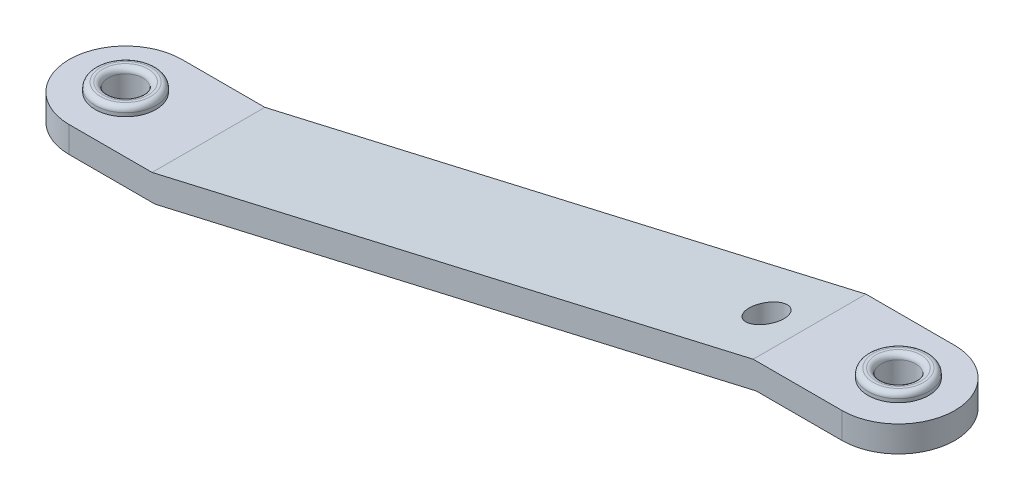
from build123d import *

# Parameters (mm, degrees)
SURFACE_EXTRUDE1_1_BACK  = 48.75
SURFACE_EXTRUDE1_1_DEPTH = 97.5
THICKEN1_T1              = 22.5
FILLET1_RADIUS           = 48.75
FILLET1_LENGTH           = 22.5
FILLET2_RADIUS           = 48.75
FILLET2_LENGTH           = 22.5
CUT_EXTRUDE2_DEPTH       = 656.697315155
CUT_EXTRUDE2_DEPTH_BACK  = 656.697315155
SKETCH2_R                = 15
BOSS_EXTRUDE1_DEPTH      = 7.5
BOSS_EXTRUDE1_DEPTH_BACK = 30
SKETCH3_R                = 26.25
SKETCH3_R_2              = 15
BOSS_EXTRUDE2_DEPTH      = 7.5
BOSS_EXTRUDE2_DEPTH_BACK = 30
SKETCH4_R                = 26.25
SKETCH4_R_2              = 15
FILLET3_R                = 4.5


with BuildPart() as body_1:
    # Surface-Extrude1: a surface, the sketch's curves swept straight by 97.5 mm
    with BuildLine(Plane.XY.offset(-SURFACE_EXTRUDE1_1_BACK), mode=Mode.PRIVATE) as surface_extrude1_1_path:
        Line((-123, 0), (0, 0))
        Line((0, 0), (519.777104914, 120))
        Line((519.777104914, 120), (642.777104914, 120))
    surface_extrude1_1 = Shell.extrude(surface_extrude1_1_path.wire(), (0 * SURFACE_EXTRUDE1_1_DEPTH, 0 * SURFACE_EXTRUDE1_1_DEPTH, 1 * SURFACE_EXTRUDE1_1_DEPTH))
    add(Solid.thicken(surface_extrude1_1, THICKEN1_T1))

    # Fillet1: full round fillet: the end face becomes a half cylinder, R = half its width
    fillet1_face = Plane((642.777104914, 131.25, 0), x_dir=(0, -1, 0), z_dir=(1, 0, 0))  # on the end face: x along it, z out of the body
    fillet1_slab = fillet1_face.offset(-FILLET1_RADIUS / 2) * Box(FILLET1_LENGTH, 2 * FILLET1_RADIUS, FILLET1_RADIUS, mode=Mode.PRIVATE)  # the body's end, R deep
    fillet1_round = Plane((594.027104914, 131.25, 0), x_dir=(1, 0, 0), z_dir=(0, -1, 0)) * Cylinder(FILLET1_RADIUS, FILLET1_LENGTH, mode=Mode.PRIVATE)  # its axis R under the face
    add(fillet1_slab - fillet1_round, mode=Mode.SUBTRACT)

    # Fillet2: full round fillet: the end face becomes a half cylinder, R = half its width
    fillet2_face = Plane((-123, 11.25, 0), x_dir=(0, 1, 0), z_dir=(-1, 0, 0))  # on the end face: x along it, z out of the body
    fillet2_slab = fillet2_face.offset(-FILLET2_RADIUS / 2) * Box(FILLET2_LENGTH, 2 * FILLET2_RADIUS, FILLET2_RADIUS, mode=Mode.PRIVATE)  # the body's end, R deep
    fillet2_round = Plane((-74.25, 11.25, 0), x_dir=(-1, 0, 0), z_dir=(0, 1, 0)) * Cylinder(FILLET2_RADIUS, FILLET2_LENGTH, mode=Mode.PRIVATE)  # its axis R under the face
    add(fillet2_slab - fillet2_round, mode=Mode.SUBTRACT)

    # Sketch2 → Cut-Extrude2 (cut, two sides: drawn at the far end of the back side and taken through both)
    with BuildSketch(Plane(origin=(0, 22.5, 0), x_dir=(1, 0, 0), z_dir=(0, 1, 0)).offset(-CUT_EXTRUDE2_DEPTH_BACK)):
        with Locations(Location((-74.25, 0, 0), (0, 0, 270))):
            Circle(SKETCH2_R)
        with Locations((480, 0)):
            Circle(SKETCH2_R)
        with Locations(Location((594.027104914, 0, 0), (0, 0, 270))):
            Circle(SKETCH2_R)
    extrude(amount=CUT_EXTRUDE2_DEPTH + CUT_EXTRUDE2_DEPTH_BACK, mode=Mode.SUBTRACT)

    # Sketch3 → Boss-Extrude1 (add, two sides: drawn at the far end of the back side and taken through both)
    with BuildSketch(Plane(origin=(0, 22.5, 0), x_dir=(1, 0, 0), z_dir=(0, 1, 0)).offset(-BOSS_EXTRUDE1_DEPTH_BACK)):
        with Locations(Location((-74.25, 0, 0), (0, 0, 270))):
            Circle(SKETCH3_R)
        with Locations(Location((-74.25, 0, 0), (0, 0, 270))):
            Circle(SKETCH3_R_2, mode=Mode.SUBTRACT)
    extrude(amount=BOSS_EXTRUDE1_DEPTH + BOSS_EXTRUDE1_DEPTH_BACK)

    # Sketch4 → Boss-Extrude2 (add, two sides: drawn at the far end of the back side and taken through both)
    with BuildSketch(Plane(origin=(0, 142.5, 0), x_dir=(1, 0, 0), z_dir=(0, 1, 0)).offset(-BOSS_EXTRUDE2_DEPTH_BACK)):
        with Locations(Location((594.027104914, 0, 0), (0, 0, 270))):
            Circle(SKETCH4_R)
        with Locations(Location((594.027104914, 0, 0), (0, 0, 270))):
            Circle(SKETCH4_R_2, mode=Mode.SUBTRACT)
    extrude(amount=BOSS_EXTRUDE2_DEPTH + BOSS_EXTRUDE2_DEPTH_BACK)

    # Fillet3
    fillet3_edges = [body_1.edges().sort_by_distance(p)[0] for p in [
        (-74.25, -7.5, -15),
        (-74.25, -7.5, -26.25),
        (-74.25, 30, -15),
        (-74.25, 30, -26.25),
        (594.027104914, 112.5, -15),
        (594.027104914, 112.5, -26.25),
        (594.027104914, 150, -15),
        (594.027104914, 150, -26.25),
    ]]
    fillet(fillet3_edges, radius=FILLET3_R)


solid = body_1.part
